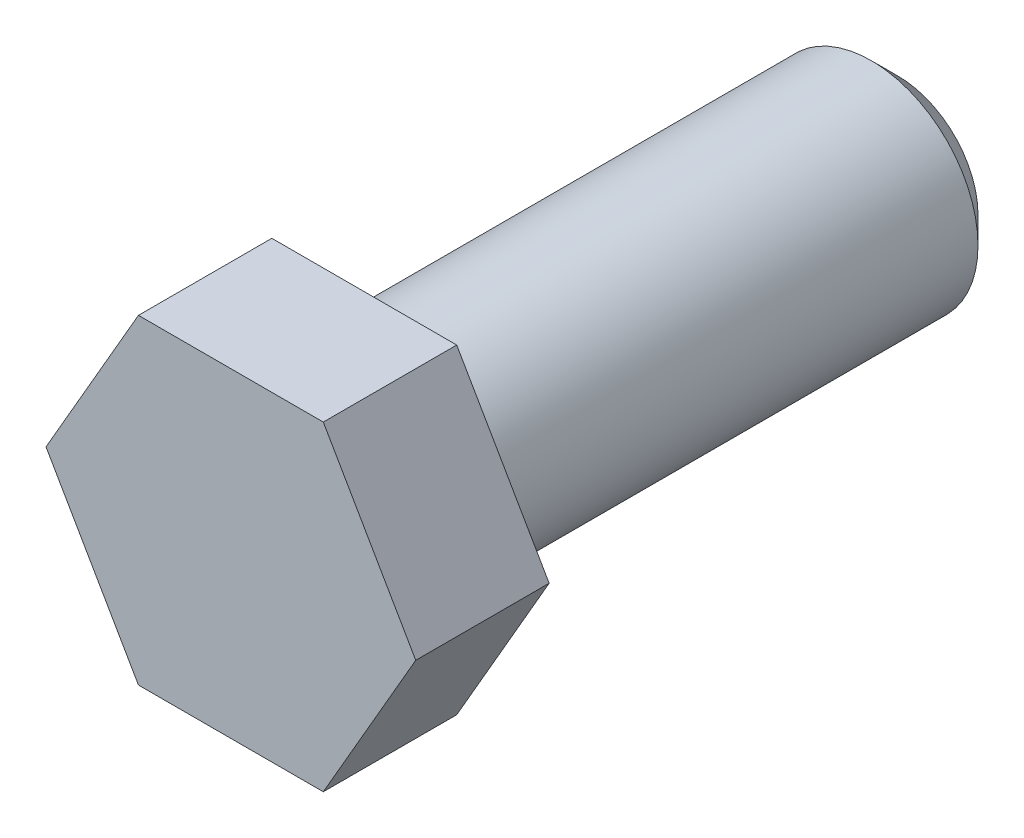
from build123d import *

# Parameters (mm, degrees)
BASE_EXTRUDE_DEPTH  = 7.5
SKETCH3_R           = 6
BOSS_EXTRUDE1_DEPTH = 30
CHAMFER1_SIZE       = 1.5


with BuildPart() as part:
    # Sketch1 → Base-Extrude (new body)
    with BuildSketch(Plane.XY):
        Polygon((-5.196152423, 9), (5.196152423, 9), (10.392304845, 0), (5.196152423, -9), (-5.196152423, -9), (-10.392304845, 0), align=None)
    extrude(amount=BASE_EXTRUDE_DEPTH)

    # Sketch3 → Boss-Extrude1 (add)
    with BuildSketch(Plane(origin=(0, 0, 0), x_dir=(-1, 0, 0), z_dir=(0, 0, -1))):
        with Locations(Location((0, 0, 0), (0, 0, 180))):
            Circle(SKETCH3_R)
    extrude(amount=BOSS_EXTRUDE1_DEPTH)

    # Chamfer1
    chamfer1_edges = [part.edges().sort_by_distance(p)[0] for p in [
        (-6, 0, -30),
    ]]
    chamfer(chamfer1_edges, length=CHAMFER1_SIZE)


solid = part.part
